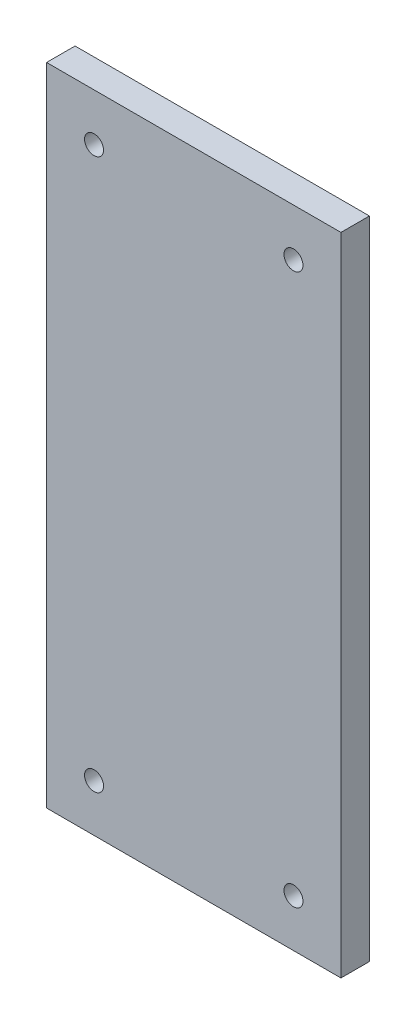
from build123d import *

# Parameters (mm, degrees)
ESQUISSE1_W         = 31
ESQUISSE1_H         = 68
BOSS_EXTRU_1_DEPTH  = 3
TROU_TARAUD_0_801_D = 2


with BuildPart() as part:
    # Esquisse1 → Boss.-Extru.1 (new body)
    with BuildSketch(Plane.XY):
        with Locations((15.5, 34)):
            Rectangle(ESQUISSE1_W, ESQUISSE1_H)
    extrude(amount=BOSS_EXTRU_1_DEPTH)

    # Trou taraudé #0-801 (through all)
    with Locations(Plane.XY.offset(3)):
        with Locations((5, 63), (26, 63), (26, 5), (5, 5)):
            Hole(TROU_TARAUD_0_801_D / 2)


solid = part.part
